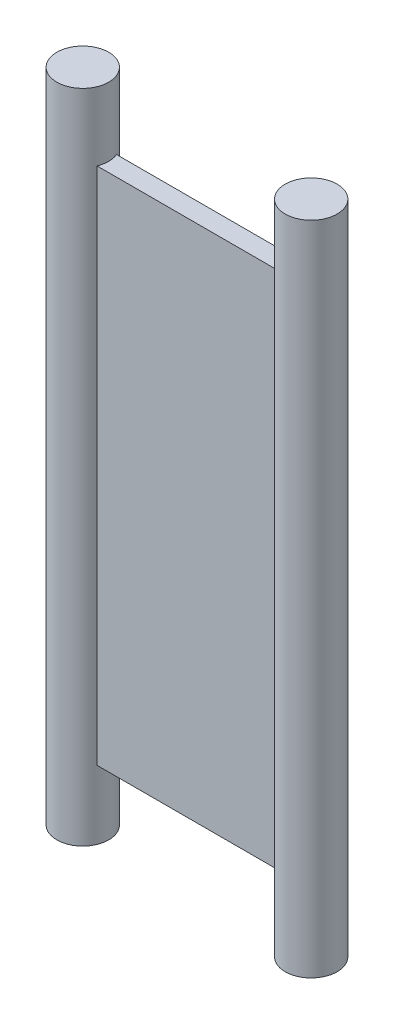
from build123d import *

# Parameters (mm, degrees)
SKETCH1_W           = 11.66
SKETCH1_H           = 1
BOSS_EXTRUDE1_DEPTH = 26.5
SKETCH2_R           = 1.325
BOSS_EXTRUDE2_DEPTH = 16.75


with BuildPart() as part:
    # Sketch1 → Boss-Extrude1 (new body)
    with BuildSketch(Plane(origin=(0, 0, 0), x_dir=(1, 0, 0), z_dir=(0, 1, 0))):
        Rectangle(SKETCH1_W, SKETCH1_H)
    extrude(amount=BOSS_EXTRUDE1_DEPTH)

    # Sketch2 → Boss-Extrude2 (add, symmetric)
    with BuildSketch(Plane(origin=(0, 13.25, 0), x_dir=(1, 0, 0), z_dir=(0, 1, 0))):
        with Locations(Location((-5.83, 0, 0), (0, 0, 270))):
            Circle(SKETCH2_R)
        with Locations(Location((5.83, 0, 0), (0, 0, 270))):
            Circle(SKETCH2_R)
    extrude(amount=BOSS_EXTRUDE2_DEPTH, both=True)


solid = part.part
